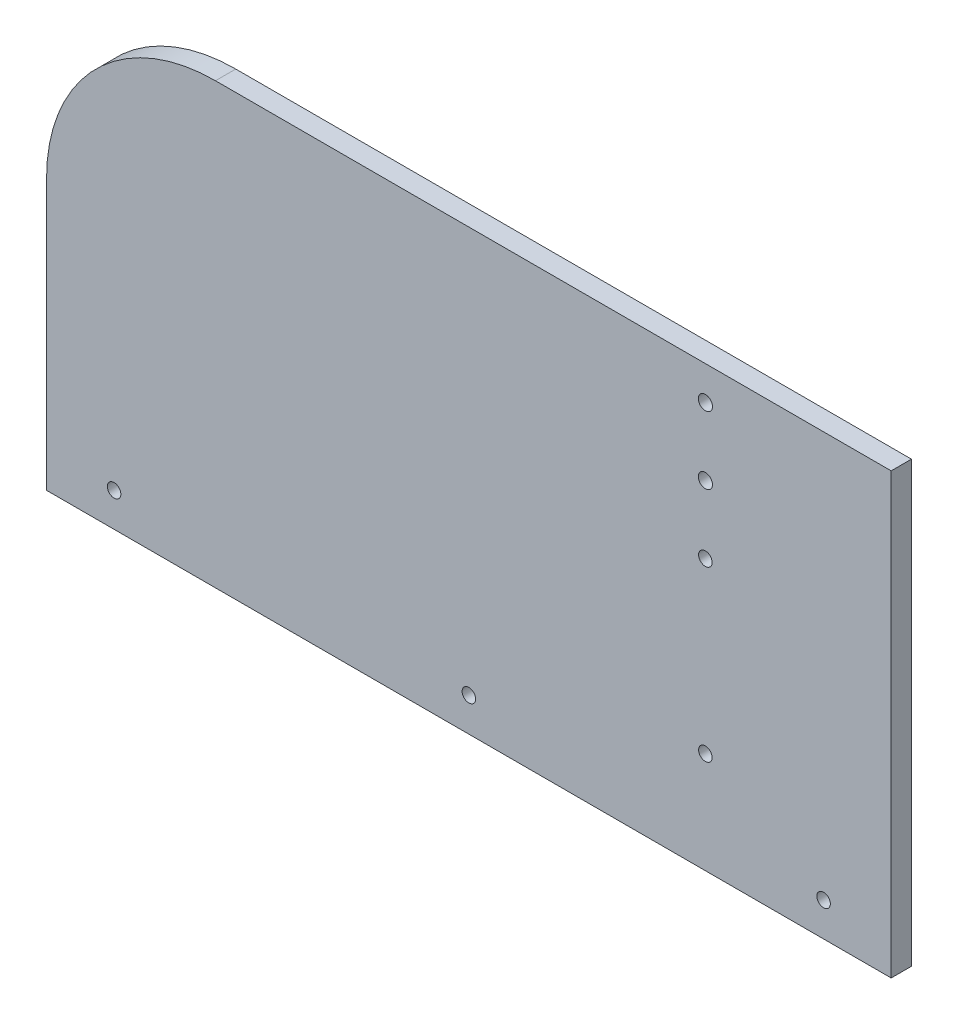
from build123d import *

# Parameters (mm, degrees)
ESBO_O1_W                = 250
ESBO_O1_H                = 130
RESSALTO_EXTRUS_O1_DEPTH = 6
FILETE1_R                = 50
ESBO_O2_R                = 2
CORTE_EXTRUS_O1_DEPTH    = 6
ESBO_O3_R                = 2.1
CORTE_EXTRUS_O2_DEPTH    = 6
ESBO_O4_R                = 2
CORTE_EXTRUS_O3_DEPTH    = 6
CHANFRO1_SIZE            = 2.3


with BuildPart() as part:
    # Esboço1 → Ressalto-extrusão1 (new body)
    with BuildSketch(Plane.XY):
        Rectangle(ESBO_O1_W, ESBO_O1_H)
    extrude(amount=RESSALTO_EXTRUS_O1_DEPTH)

    # Filete1
    filete1_edges = [part.edges().sort_by_distance(p)[0] for p in [
        (-125, 65, 3),
    ]]
    fillet(filete1_edges, radius=FILETE1_R)

    # Esboço2 → Corte-extrusão1 (cut)
    with BuildSketch(Plane(origin=(0, 0, 0), x_dir=(-1, 0, 0), z_dir=(0, 0, -1))):
        with Locations((0, -55)):
            Circle(ESBO_O2_R)
        with Locations((105, -55)):
            Circle(ESBO_O2_R)
        with Locations((-105, -55)):
            Circle(ESBO_O2_R)
    extrude(amount=-CORTE_EXTRUS_O1_DEPTH, mode=Mode.SUBTRACT)

    # Esboço3 → Corte-extrusão2 (cut)
    with BuildSketch(Plane(origin=(0, 0, 0), x_dir=(-1, 0, 0), z_dir=(0, 0, -1))):
        with Locations((-70, 55)):
            Circle(ESBO_O3_R)
        with Locations((-70, 35)):
            Circle(ESBO_O3_R)
    extrude(amount=-CORTE_EXTRUS_O2_DEPTH, mode=Mode.SUBTRACT)

    # Esboço4 → Corte-extrusão3 (cut)
    with BuildSketch(Plane(origin=(0, 0, 0), x_dir=(-1, 0, 0), z_dir=(0, 0, -1))):
        with Locations((-70, 15)):
            Circle(ESBO_O4_R)
        with Locations((-70, -35)):
            Circle(ESBO_O4_R)
    extrude(amount=-CORTE_EXTRUS_O3_DEPTH, mode=Mode.SUBTRACT)

    # Chanfro1
    chanfro1_edges = [part.edges().sort_by_distance(p)[0] for p in [
        (-103, -55, 0),
        (2, -55, 0),
        (107, -55, 0),
        (72.1, 55, 0),
        (72.1, 35, 0),
        (72, 15, 0),
        (72, -35, 0),
    ]]
    chamfer(chanfro1_edges, length=CHANFRO1_SIZE)


solid = part.part
